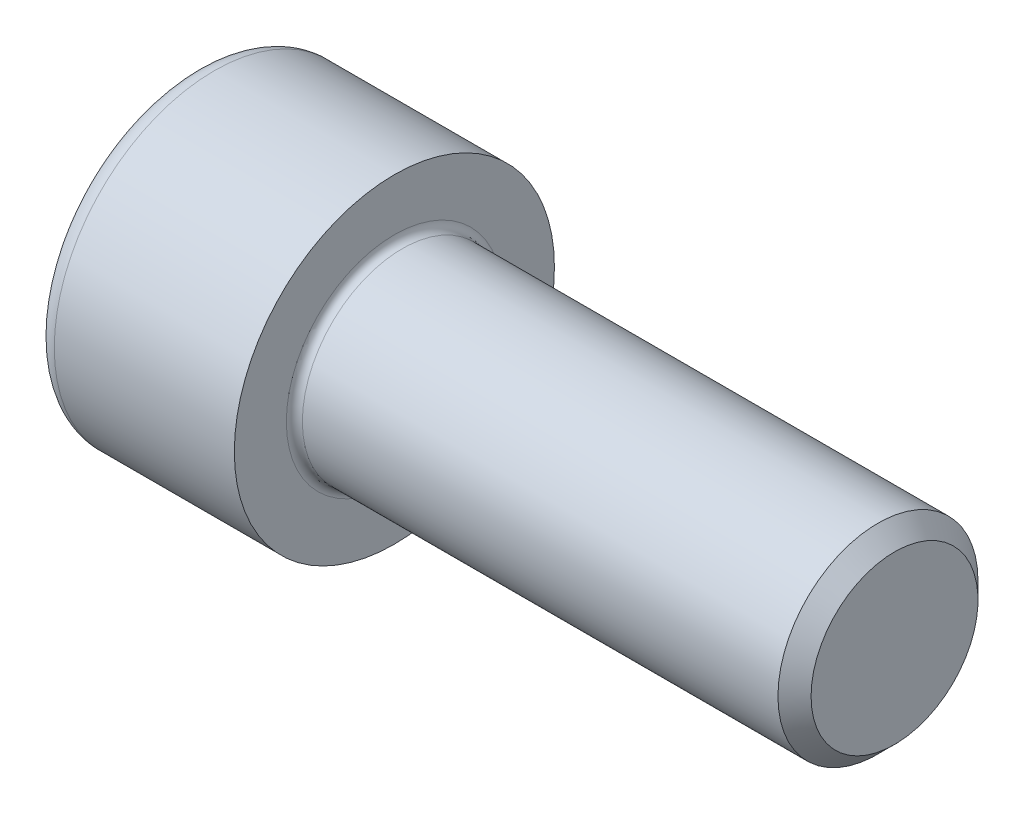
from build123d import *

# Parameters (mm, degrees)
FILLET1_R   = 0.4
FILLET2_R   = 1
HEX_2_DEPTH = 5


with BuildPart() as part:
    # BodySke → Base-Revolve (revolve)
    with BuildSketch(Plane.XY, mode=Mode.PRIVATE) as base_revolve_sk:
        Polygon((0, 0), (0, 8), (10, 8), (10, 5), (34.172, 5), (35, 4.172), (35, 0), align=None)
    revolve(base_revolve_sk.sketch.rotate(Axis((-31.75, 0, 0), (1, 0, 0)), 90), axis=Axis((-31.75, 0, 0), (1, 0, 0)))

    # Fillet1
    fillet1_edges = [part.edges().sort_by_distance(p)[0] for p in [
        (10, 0, -5),
    ]]
    fillet(fillet1_edges, radius=FILLET1_R)

    # Fillet2
    fillet2_edges = [part.edges().sort_by_distance(p)[0] for p in [
        (0, 0, -8),
    ]]
    fillet(fillet2_edges, radius=FILLET2_R)

    # Sketch2 → Hex-PreBroach (revolve, cut)
    with BuildSketch(Plane.XY, mode=Mode.PRIVATE) as hex_prebroach_sk:
        Polygon((0, 4.0125), (5, 4.0125), (7.316617955, 0), (0, 0), align=None)
    revolve(hex_prebroach_sk.sketch.rotate(Axis((0, 0, 0), (1, 0, 0)), 90), axis=Axis((0, 0, 0), (1, 0, 0)), mode=Mode.SUBTRACT)

    # Sketch3 → Hex 2 (cut)
    with BuildSketch(Plane(origin=(0, 0, 0), x_dir=(0, 0.500000000000001, 0.866025403784438), z_dir=(-1, 0, 0))):
        Polygon((2.316617955, 4.0125), (-2.316617955, 4.0125), (-4.63323591, 0), (-2.316617955, -4.0125), (2.316617955, -4.0125), (4.63323591, 0), align=None)
    extrude(amount=-HEX_2_DEPTH, mode=Mode.SUBTRACT)


solid = part.part
